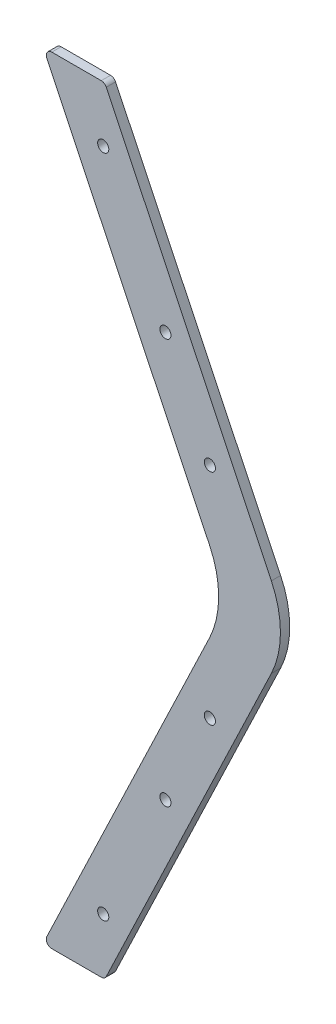
from build123d import *

# Parameters (mm, degrees)
Y_KSEKLIK_EKSTR_ZYON1_DEPTH = 5
RADYUS1_R                   = 3
RADYUS2_R                   = 50
IZIM2_R                     = 3
KES_EKSTR_ZYON1_DEPTH       = 10


with BuildPart() as part:
    # Çizim1 → Yükseklik-Ekstrüzyon1 (new body)
    with BuildSketch(Plane.XY):
        Polygon((0, 209), (100, 0), (0, -209), (33.257168235, -209), (133.257168235, 0), (33.257168235, 209), align=None)
    extrude(amount=Y_KSEKLIK_EKSTR_ZYON1_DEPTH)

    # Radyus1
    radyus1_edges = [part.edges().sort_by_distance(p)[0] for p in [
        (0, -209, 2.5),
        (0, 209, 2.5),
        (33.257168235, 209, 2.5),
        (33.257168235, -209, 2.5),
    ]]
    fillet(radyus1_edges, radius=RADYUS1_R)

    # Radyus2
    radyus2_edges = [part.edges().sort_by_distance(p)[0] for p in [
        (100, 0, 2.5),
        (133.257168235, 0, 2.5),
    ]]
    fillet(radyus2_edges, radius=RADYUS2_R)

    # Çizim2 → Kes-Ekstrüzyon1 (cut)
    with BuildSketch(Plane.XY.offset(5)):
        with Locations((32.418057802, 179)):
            Circle(IZIM2_R)
        with Locations((65.910880768, 109)):
            Circle(IZIM2_R)
        with Locations((89.834325744, 59)):
            Circle(IZIM2_R)
        with Locations((89.834325744, -59)):
            Circle(IZIM2_R)
        with Locations((65.910880768, -109)):
            Circle(IZIM2_R)
        with Locations((32.418057802, -179)):
            Circle(IZIM2_R)
    extrude(amount=-KES_EKSTR_ZYON1_DEPTH, mode=Mode.SUBTRACT)


solid = part.part
